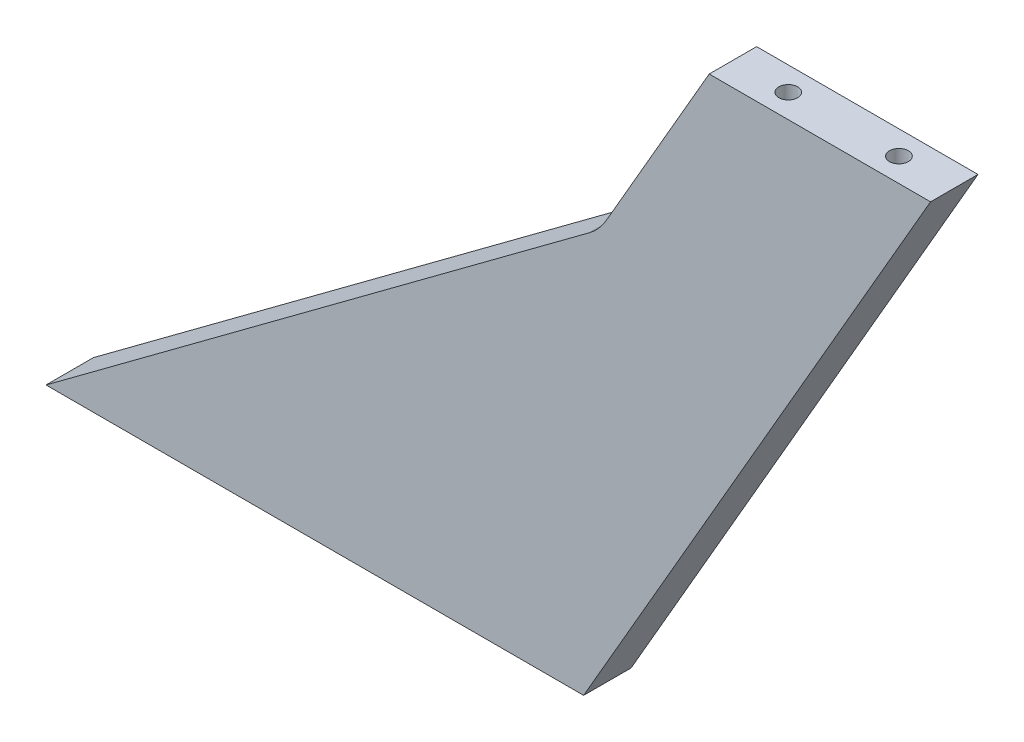
from build123d import *

# Parameters (mm, degrees)
SKETCH1_W                  = 44.45
SKETCH1_H                  = 9.525
F_10_24_TAPPED_HOLE1_D     = 3.7973
F_10_24_TAPPED_HOLE1_DEPTH = 12.954
F_10_24_TAPPED_HOLE2_D     = 3.7973
F_10_24_TAPPED_HOLE2_DEPTH = 9.652
BOSS_EXTRUDE1_DEPTH        = 9.525
F_10_24_TAPPED_HOLE3_D     = 3.7973
F_10_24_TAPPED_HOLE3_DEPTH = 12.954
F_10_24_TAPPED_HOLE3_TIP   = 1.140824014
FILLET1_R                  = 12.7


with BuildPart() as part:
    # Sweep1: sweep along a path in Sketch2
    with BuildLine(Plane.XY) as sweep1_path:
        Line((-22.225, 0), (47.432309978, 120.65))
    # Sketch1 → Sweep1 (sweep)
    with BuildSketch(Plane(origin=(0, 0, 0), x_dir=(1, 0, 0), z_dir=(0, 1, 0))):
        Rectangle(SKETCH1_W, SKETCH1_H)
    sweep(path=sweep1_path.line)

    # #10-24 Tapped Hole1
    with Locations(Plane(origin=(0, 0, 0), x_dir=(-1, 0, 0), z_dir=(0, -1, 0))):
        with Locations((11.1125, 0), (-11.1125, 0)):
            Hole(F_10_24_TAPPED_HOLE1_D / 2, depth=F_10_24_TAPPED_HOLE1_DEPTH)

    # #10-24 Tapped Hole2
    with Locations(Plane(origin=(0, 120.65, 0), x_dir=(1, 0, 0), z_dir=(0, 1, 0))):
        with Locations((58.544809978, 0), (80.769809978, 0)):
            Hole(F_10_24_TAPPED_HOLE2_D / 2, depth=F_10_24_TAPPED_HOLE2_DEPTH)

    # Sketch14 → Boss-Extrude1 (add)
    with BuildSketch(Plane.XY.offset(4.7625)):
        Polygon((-22.225, 0), (-85.725, 0), (25.435264722, 82.55), align=None)
    extrude(amount=-BOSS_EXTRUDE1_DEPTH)

    # #10-24 Tapped Hole3
    with Locations(Plane(origin=(0, 0, 0), x_dir=(-1, 0, 0), z_dir=(0, -1, 0))):
        with Locations((42.8625, 0), (65.0875, 0)):
            Hole(F_10_24_TAPPED_HOLE3_D / 2, depth=F_10_24_TAPPED_HOLE3_DEPTH)
            with Locations((0, 0, -(F_10_24_TAPPED_HOLE3_DEPTH + F_10_24_TAPPED_HOLE3_TIP / 2))):  # 118° drill point
                Cone(0, F_10_24_TAPPED_HOLE3_D / 2, F_10_24_TAPPED_HOLE3_TIP, mode=Mode.SUBTRACT)

    # Fillet1
    fillet1_edges = [part.edges().sort_by_distance(p)[0] for p in [
        (25.435264722, 82.55, 0),
    ]]
    fillet(fillet1_edges, radius=FILLET1_R)


solid = part.part
